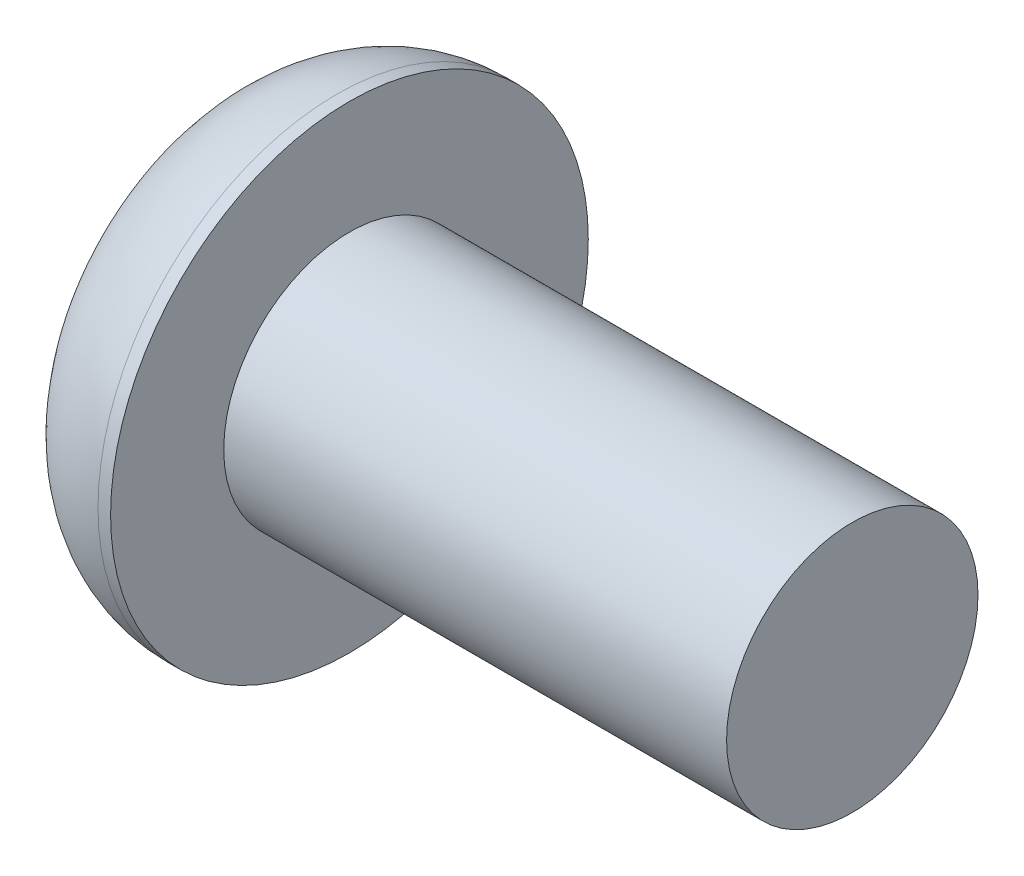
from build123d import *

# Parameters (mm, degrees)
CUT_EXTRUDE1_DEPTH = 1.04


with BuildPart() as part:
    # Sketch1 → Revolve1 (revolve)
    with BuildSketch(Plane(origin=(0, 0, 0), x_dir=(1, 0, 0), z_dir=(0, 1, 0))):
        with BuildLine():
            Line((0, 0), (7.65, 0))
            Line((7.65, 0), (7.65, 1.5))
            Line((7.65, 1.5), (1.65, 1.5))
            Line((1.65, 1.5), (1.65, 2.85))
            Line((1.65, 2.85), (1.5, 2.85))
            ThreePointArc((1.5, 2.85), (0.439339828, 2.410660172), (0, 1.35))
            Line((0, 1.35), (0, 0))
        make_face()
    revolve(axis=Axis((0, 0, 0), (-1, 0, 0)))

    # Sketch2 → Cut-Extrude1 (cut)
    with BuildSketch(Plane.ZY):
        Polygon((1.154700538, 0), (0.577350269, 1), (-0.577350269, 1), (-1.154700538, 0), (-0.577350269, -1), (0.577350269, -1), align=None)
    extrude(amount=-CUT_EXTRUDE1_DEPTH, mode=Mode.SUBTRACT)


solid = part.part
